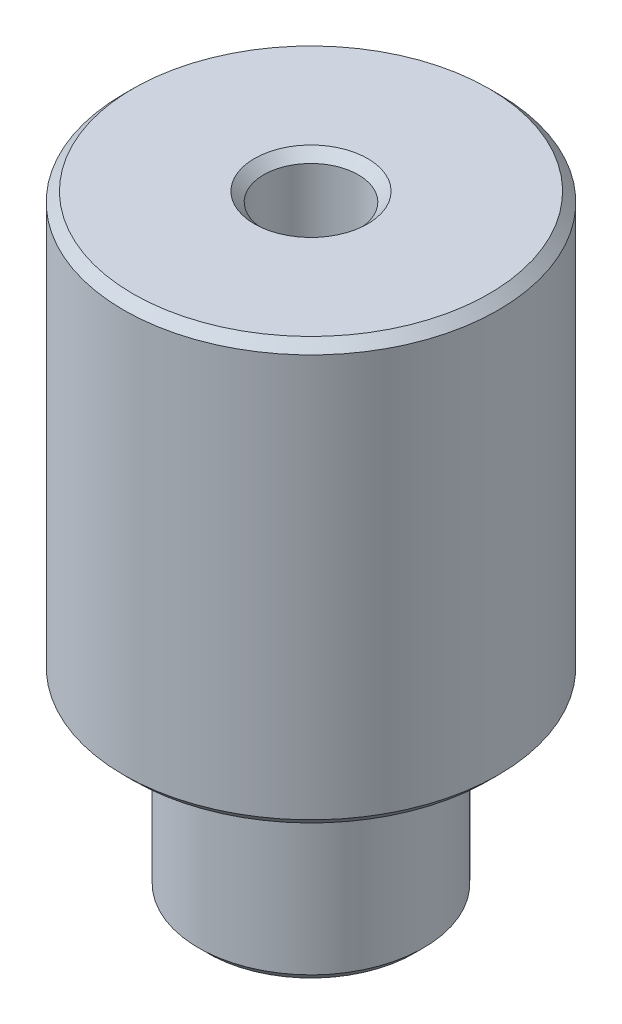
from build123d import *

# Parameters (mm, degrees)
SKETCH2_R          = 5.05
CUT_EXTRUDE1_DEPTH = 71.887234394
CHAMFER1_SIZE      = 1


with BuildPart() as part:
    # Sketch1 → Revolve1 (revolve)
    with BuildSketch(Plane.XY, mode=Mode.PRIVATE) as revolve1_sk:
        Polygon((0, 0), (20, 0), (20, -45), (12, -45), (12, -65), (0, -65), align=None)
    revolve(revolve1_sk.sketch.rotate(Axis((0, -70, 0), (0, 1, 0)), 90), axis=Axis((0, -70, 0), (0, 1, 0)))

    # Sketch2 → Cut-Extrude1 (cut, through all)
    with BuildSketch(Plane(origin=(0, 0, 0), x_dir=(1, 0, 0), z_dir=(0, 1, 0))):
        with Locations(Location((0, 0, 0), (0, 0, 180))):
            Circle(SKETCH2_R)
    extrude(amount=-CUT_EXTRUDE1_DEPTH, mode=Mode.SUBTRACT)

    # Chamfer1
    chamfer1_edges = [part.edges().sort_by_distance(p)[0] for p in [
        (5.05, -65, 0),
        (5.05, 0, 0),
        (0, -65, 12),
        (0, -45, 20),
        (0, 0, 20),
    ]]
    chamfer(chamfer1_edges, length=CHAMFER1_SIZE)


solid = part.part
